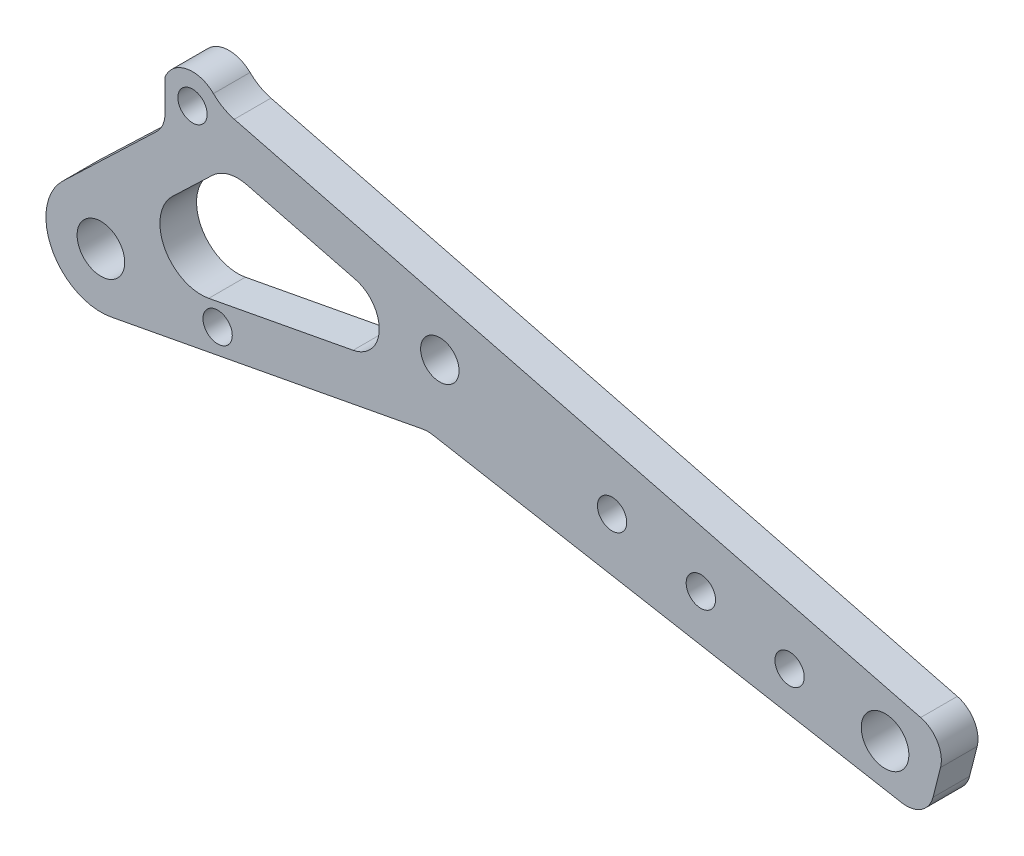
from build123d import *

# Parameters (mm, degrees)
SKETCH_1_R          = 2.1
EXTRUDE_1_DEPTH     = 4
FILLET_3_R          = 5
CUT_EXTRUDE_1_DEPTH = 48.602520942
SKETCH_5_R          = 1.6
CUT_EXTRUDE_4_DEPTH = 45.060309279
SKETCH_6_R          = 2.6
EXTRUDE_3_DEPTH     = 4
FILLET_4_R          = 3
EXTRUDE_6_DEPTH     = 4
SKETCH_8_R          = 1.6
CUT_EXTRUDE_5_DEPTH = 59.484887667
CUT_EXTRUDE_6_DEPTH = 59.484887667
SKETCH_10_R         = 1.6
EXTRUDE_5_DEPTH     = 4
CUT_EXTRUDE_7_DEPTH = 59.131742072
FILLET_5_R          = 3
SKETCH_13_R         = 2.6
CUT_EXTRUDE_8_DEPTH = 10
SKETCH_14_R         = 1.6
CUT_EXTRUDE_9_DEPTH = 10


with BuildPart() as part:
    # 草图1 → 凸台-拉伸1 (new body)
    with BuildSketch(Plane.XY):
        with BuildLine():
            Line((-30, 15), (-30, 8))
            Line((-30, 8), (-3.625760775, -6.565352908))
            ThreePointArc((-3.625760775, -6.565352908), (-2.508336586, -7.068114853), (-1.323960706, -7.382217014))
            Line((-1.323960706, -7.382217014), (30, -13))
            Line((30, -13), (40, -13))
            ThreePointArc((40, -13), (44.961129361, -8.622250323), (41.234825739, -3.154878186))
            Line((41.234825739, -3.154878186), (-8.89090638, 9.620145142))
            Line((-8.89090638, 9.620145142), (-30, 15))
        make_face()
        Circle(SKETCH_1_R, mode=Mode.SUBTRACT)
    extrude(amount=EXTRUDE_1_DEPTH)

    # 圆角3
    fillet_3_edges = [part.edges().sort_by_distance(p)[0] for p in [
        (30, -13, 2),
    ]]
    fillet(fillet_3_edges, radius=FILLET_3_R)

    # 草图2 → 切除-拉伸1 (cut, through all)
    with BuildSketch(Plane.XY.offset(4)):
        Polygon((41.234825739, -3.154878186), (38.343573198, -14.499370217), (44.079449635, -18.425378343), (50.650422799, -6.675561263), (42.473370603, -0.777871599), align=None)
    extrude(amount=-CUT_EXTRUDE_1_DEPTH, mode=Mode.SUBTRACT)

    # 草图5 → 切除-拉伸4 (cut, through all)
    with BuildSketch(Plane.XY.offset(4)):
        with Locations((-27, 10.5)):
            Circle(SKETCH_5_R)
        with BuildLine():
            Line((-27, 13.75), (-27.802461724, 17.848471623))
            Line((-27.802461724, 17.848471623), (-34.200130402, 16.595837785))
            Line((-34.200130402, 16.595837785), (-34.200130402, 10.5))
            Line((-34.200130402, 10.5), (-30.25, 10.5))
            ThreePointArc((-30.25, 10.5), (-29.298097039, 12.798097039), (-27, 13.75))
        make_face()
    extrude(amount=-CUT_EXTRUDE_4_DEPTH, mode=Mode.SUBTRACT)

    # 草图6 → 凸台-拉伸3 (add)
    with BuildSketch(Plane.XY.offset(4)):
        with BuildLine():
            Line((-1.323960706, -7.382217014), (-35.888817872, -13.896208466))
            ThreePointArc((-35.888817872, -13.896208466), (-42.336413013, -10.742753389), (-41.147636408, -3.664436343))
            Line((-41.147636408, -3.664436343), (-30, 7))
            Line((-30, 7), (-30, 8))
            Line((-30, 8), (-1.323960706, -7.382217014))
        make_face()
        with Locations((-37, -8)):
            Circle(SKETCH_6_R, mode=Mode.SUBTRACT)
    extrude(amount=-EXTRUDE_3_DEPTH)

    # 圆角4
    fillet_4_edges = [part.edges().sort_by_distance(p)[0] for p in [
        (41.234825739, -3.154878186, 2),
        (-1.323960706, -7.382217014, 2),
        (38.725702071, -13, 2),
        (-30, 7, 2),
    ]]
    fillet(fillet_4_edges, radius=FILLET_4_R)

    # 草图12 → 凸台-拉伸6 (add, through all)
    with BuildSketch(Plane(origin=(0, 0, 0), x_dir=(-1, 0, 0), z_dir=(0, 0, -1))):
        Polygon((-38.32775265, -2.413982742), (-55.770191182, -6.859355403), (-53.147184729, -17.151322425), (-28.912835061, -12.805022846), align=None)
    extrude(amount=-EXTRUDE_6_DEPTH)

    # 草图8 → 切除-拉伸5 (cut, through all)
    with BuildSketch(Plane(origin=(0, 0, 0), x_dir=(-1, 0, 0), z_dir=(0, 0, -1))):
        with Locations((-18.803711615, -5.177837216)):
            Circle(SKETCH_8_R)
        with Locations((-28.493955243, -7.647488694)):
            Circle(SKETCH_8_R)
        with Locations((-38.184198872, -10.117140172)):
            Circle(SKETCH_8_R)
    extrude(amount=-CUT_EXTRUDE_5_DEPTH, mode=Mode.SUBTRACT)

    # 草图9 → 切除-拉伸6 (cut, through all)
    with BuildSketch(Plane(origin=(0, 0, 0), x_dir=(-1, 0, 0), z_dir=(0, 0, -1))):
        with BuildLine():
            Line((30, 11.75), (30, 25.879948008))
            Line((30, 25.879948008), (-59.978637955, 25.879948008))
            Line((-59.978637955, 25.879948008), (-59.978637955, -9.479867102))
            Line((-59.978637955, -9.479867102), (22.437617221, 11.52470556))
            ThreePointArc((22.437617221, 11.52470556), (23.662682687, 12.016789899), (24.71625119, 12.812356238))
            ThreePointArc((24.71625119, 12.812356238), (27.640627923, 13.686235375), (30, 11.75))
        make_face()
    extrude(amount=-CUT_EXTRUDE_6_DEPTH, mode=Mode.SUBTRACT)

    # 草图10 → 凸台-拉伸5 (add, through all)
    with BuildSketch(Plane(origin=(0, 0, 0), x_dir=(-1, 0, 0), z_dir=(0, 0, -1))):
        with BuildLine():
            Line((30, 11.75), (30, 9.25))
            ThreePointArc((30, 9.25), (23.75, 10.5), (30, 11.75))
        make_face()
        with Locations(Location((27, 10.5, 0), (0, 0, 180))):
            Circle(SKETCH_10_R, mode=Mode.SUBTRACT)
    extrude(amount=-EXTRUDE_5_DEPTH)

    # 草图11 → 切除-拉伸7 (cut, through all)
    with BuildSketch(Plane(origin=(0, 0, 0), x_dir=(-1, 0, 0), z_dir=(0, 0, -1))):
        with BuildLine():
            Line((24.825037002, 5.031136033), (29.169175717, 0.875296258))
            ThreePointArc((29.169175717, 0.875296258), (30.06075817, -4.433441527), (25.225061815, -6.798532835))
            Line((25.225061815, -6.798532835), (9.462787836, -3.82802098))
            ThreePointArc((9.462787836, -3.82802098), (6.612728883, -0.499278448), (9.246599393, 3.003019229))
            Line((9.246599393, 3.003019229), (21.072085472, 6.016857713))
            ThreePointArc((21.072085472, 6.016857713), (23.076090116, 6.009539302), (24.825037002, 5.031136033))
        make_face()
    extrude(amount=-CUT_EXTRUDE_7_DEPTH, mode=Mode.SUBTRACT)

    # 圆角5
    fillet_5_edges = [part.edges().sort_by_distance(p)[0] for p in [
        (53.147184729, -17.151322425, 2),
        (55.39974346, -8.312891947, 2),
    ]]
    fillet(fillet_5_edges, radius=FILLET_5_R)

    # 草图13 → 切除-拉伸8 (cut)
    with BuildSketch(Plane(origin=(0, 0, 0), x_dir=(-1, 0, 0), z_dir=(0, 0, -1))):
        with Locations((-48.605919829, -11.741249861)):
            Circle(SKETCH_13_R)
    extrude(amount=-CUT_EXTRUDE_8_DEPTH, mode=Mode.SUBTRACT)

    # 草图14 → 切除-拉伸9 (cut)
    with BuildSketch(Plane.XY.offset(4)):
        with Locations((-24.257929074, -9.024692947)):
            Circle(SKETCH_14_R)
    extrude(amount=-CUT_EXTRUDE_9_DEPTH, mode=Mode.SUBTRACT)


solid = part.part
